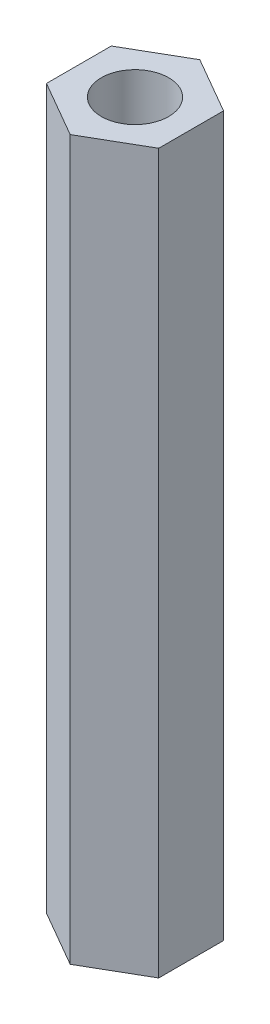
from build123d import *

# Parameters (mm, degrees)
EXTRUDE_1_DEPTH     = 32
CUT_EXTRUDE_1_REACH = 34.227
SKETCH_2_R          = 1.5


with BuildPart() as part:
    # 草圖1 → 填料-伸長1 (new body)
    with BuildSketch(Plane(origin=(0, 0, 0), x_dir=(1, 0, 0), z_dir=(0, 1, 0))):
        Polygon((0, 2.886751346), (-2.5, 1.443375673), (-2.5, -1.443375673), (0, -2.886751346), (2.5, -1.443375673), (2.5, 1.443375673), align=None)
    extrude(amount=EXTRUDE_1_DEPTH)

    # 草圖2 → 除料-伸長1 (cut, up to next)
    with BuildSketch(Plane(origin=(0, 32, 0), x_dir=(-1, 0, 0), z_dir=(0, 1, 0)), mode=Mode.PRIVATE) as cut_extrude_1_sk1:
        with Locations(Location((0, 0, 0), (0, 0, 90))):
            Circle(SKETCH_2_R)
    cut_extrude_1_tool1 = extrude(cut_extrude_1_sk1.sketch, amount=-CUT_EXTRUDE_1_REACH, mode=Mode.PRIVATE) & part.part
    add(cut_extrude_1_tool1.solids().sort_by_distance((0, 32, 0))[0], mode=Mode.SUBTRACT)


solid = part.part
